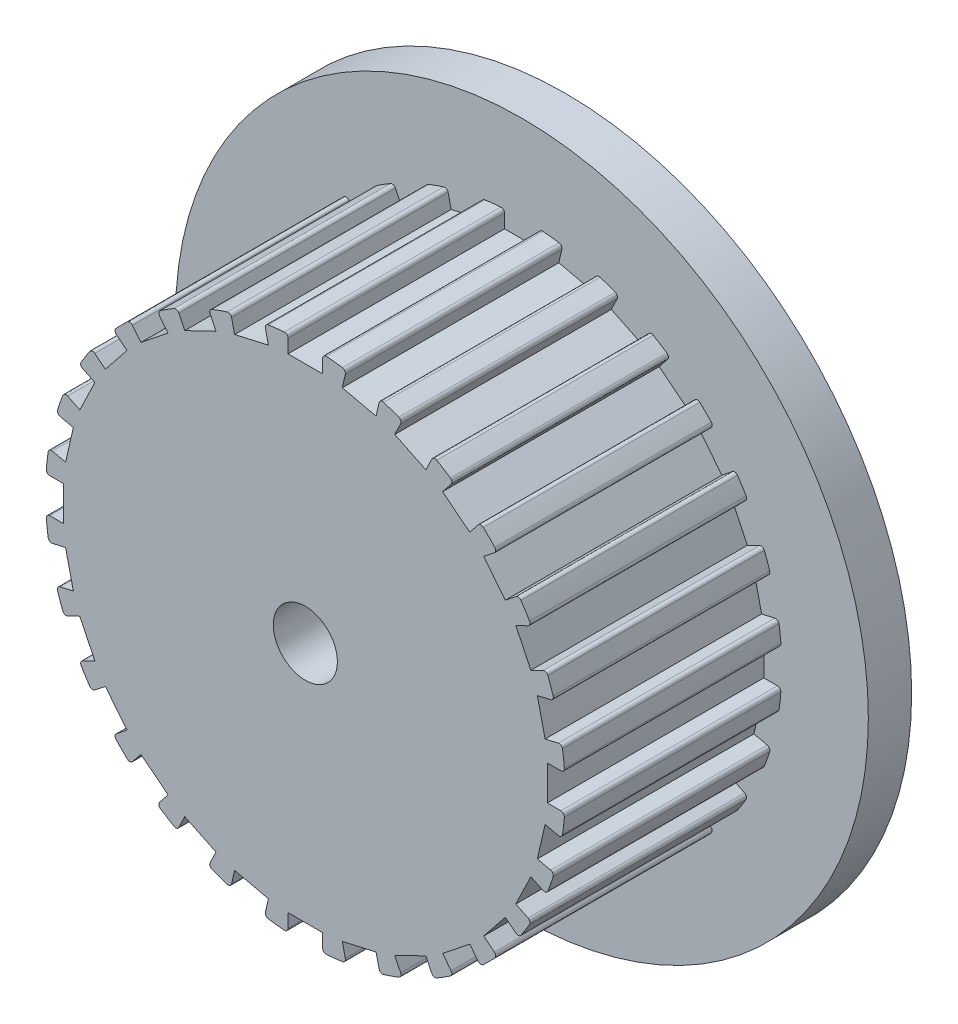
from build123d import *

# Parameters (mm, degrees)
SKETCH1_R                = 12.7
BOSS_EXTRUDE1_DEPTH      = 1.5875
SKETCH2_R                = 9.525
BOSS_EXTRUDE2_DEPTH      = 7.9375
SKETCH3_R                = 1.175
CUT_EXTRUDE1_DEPTH       = 21.329919454
SKETCH4_W                = 1.27
SKETCH4_H                = 0.635
CUT_EXTRUDE2_DEPTH       = 7.9375
FILLET2_R                = 0.127
CIRPATTERN1_COUNT        = 28
FILLET2_OF_CIRPATTERN1_R = 0.127


with BuildPart() as part:
    # Sketch1 → Boss-Extrude1 (new body)
    with BuildSketch(Plane.XY):
        Circle(SKETCH1_R)
    extrude(amount=BOSS_EXTRUDE1_DEPTH)

    # Sketch2 → Boss-Extrude2 (add)
    with BuildSketch(Plane.XY.offset(1.5875)):
        Circle(SKETCH2_R)
    extrude(amount=BOSS_EXTRUDE2_DEPTH)

    # Sketch3 → Cut-Extrude1 (cut, through all)
    with BuildSketch(Plane.XY.offset(9.525)):
        Circle(SKETCH3_R)
    extrude(amount=-CUT_EXTRUDE1_DEPTH, mode=Mode.SUBTRACT)

    # Sketch4 → Cut-Extrude2 (cut)
    with BuildSketch(Plane.XY.offset(9.525)):
        with Locations((0, 9.821309762)):
            Rectangle(SKETCH4_W, SKETCH4_H)
        with Locations((0, 9.186309762)):
            Rectangle(SKETCH4_W, SKETCH4_H)
    cut_extrude2 = extrude(amount=-CUT_EXTRUDE2_DEPTH, mode=Mode.SUBTRACT)

    # Fillet2
    fillet2_edges = [part.edges().sort_by_distance(p)[0] for p in [
        (-0.635, 9.503809762, 5.55625),
        (0.635, 9.503809762, 5.55625),
    ]]
    fillet(fillet2_edges, radius=FILLET2_R)

    # CirPattern1: Cut-Extrude2 ×28 about axis
    cirpattern1_axis = Axis((0, 0, 0), (0, 0, 1))
    for i in range(1, CIRPATTERN1_COUNT):
        add(cut_extrude2.rotate(cirpattern1_axis, i * 360 / CIRPATTERN1_COUNT), mode=Mode.SUBTRACT)

    # Fillet2 of CirPattern1
    fillet2_of_cirpattern1_edges = [part.edges().sort_by_distance(p)[0] for p in [
        (-2.733875849, 9.124228616, 5.55625),
        (-1.4957174, 9.406830202, 5.55625),
        (-4.695663747, 8.287120548, 5.55625),
        (-3.551433284, 8.838152897, 5.55625),
        (-6.421991457, 7.034461651, 5.55625),
        (-5.429065474, 7.8262937, 5.55625),
        (-7.8262937, 5.429065474, 5.55625),
        (-7.034461651, 6.421991457, 5.55625),
        (-8.838152897, 3.551433284, 5.55625),
        (-8.287120548, 4.695663747, 5.55625),
        (-9.406830202, 1.4957174, 5.55625),
        (-9.124228616, 2.733875849, 5.55625),
        (-9.503809762, -0.635, 5.55625),
        (-9.503809762, 0.635, 5.55625),
        (-9.124228616, -2.733875849, 5.55625),
        (-9.406830202, -1.4957174, 5.55625),
        (-8.287120548, -4.695663747, 5.55625),
        (-8.838152897, -3.551433284, 5.55625),
        (-7.034461651, -6.421991457, 5.55625),
        (-7.8262937, -5.429065474, 5.55625),
        (-5.429065474, -7.8262937, 5.55625),
        (-6.421991457, -7.034461651, 5.55625),
        (-3.551433284, -8.838152897, 5.55625),
        (-4.695663747, -8.287120548, 5.55625),
        (-1.4957174, -9.406830202, 5.55625),
        (-2.733875849, -9.124228616, 5.55625),
        (0.635, -9.503809762, 5.55625),
        (-0.635, -9.503809762, 5.55625),
        (2.733875849, -9.124228616, 5.55625),
        (1.4957174, -9.406830202, 5.55625),
        (4.695663747, -8.287120548, 5.55625),
        (3.551433284, -8.838152897, 5.55625),
        (6.421991457, -7.034461651, 5.55625),
        (5.429065474, -7.8262937, 5.55625),
        (7.8262937, -5.429065474, 5.55625),
        (7.034461651, -6.421991457, 5.55625),
        (8.838152897, -3.551433284, 5.55625),
        (8.287120548, -4.695663747, 5.55625),
        (9.406830202, -1.4957174, 5.55625),
        (9.124228616, -2.733875849, 5.55625),
        (9.503809762, 0.635, 5.55625),
        (9.503809762, -0.635, 5.55625),
        (9.124228616, 2.733875849, 5.55625),
        (9.406830202, 1.4957174, 5.55625),
        (8.287120548, 4.695663747, 5.55625),
        (8.838152897, 3.551433284, 5.55625),
        (7.034461651, 6.421991457, 5.55625),
        (7.8262937, 5.429065474, 5.55625),
        (5.429065474, 7.8262937, 5.55625),
        (6.421991457, 7.034461651, 5.55625),
        (3.551433284, 8.838152897, 5.55625),
        (4.695663747, 8.287120548, 5.55625),
        (1.4957174, 9.406830202, 5.55625),
        (2.733875849, 9.124228616, 5.55625),
    ]]
    fillet(fillet2_of_cirpattern1_edges, radius=FILLET2_OF_CIRPATTERN1_R)


solid = part.part
